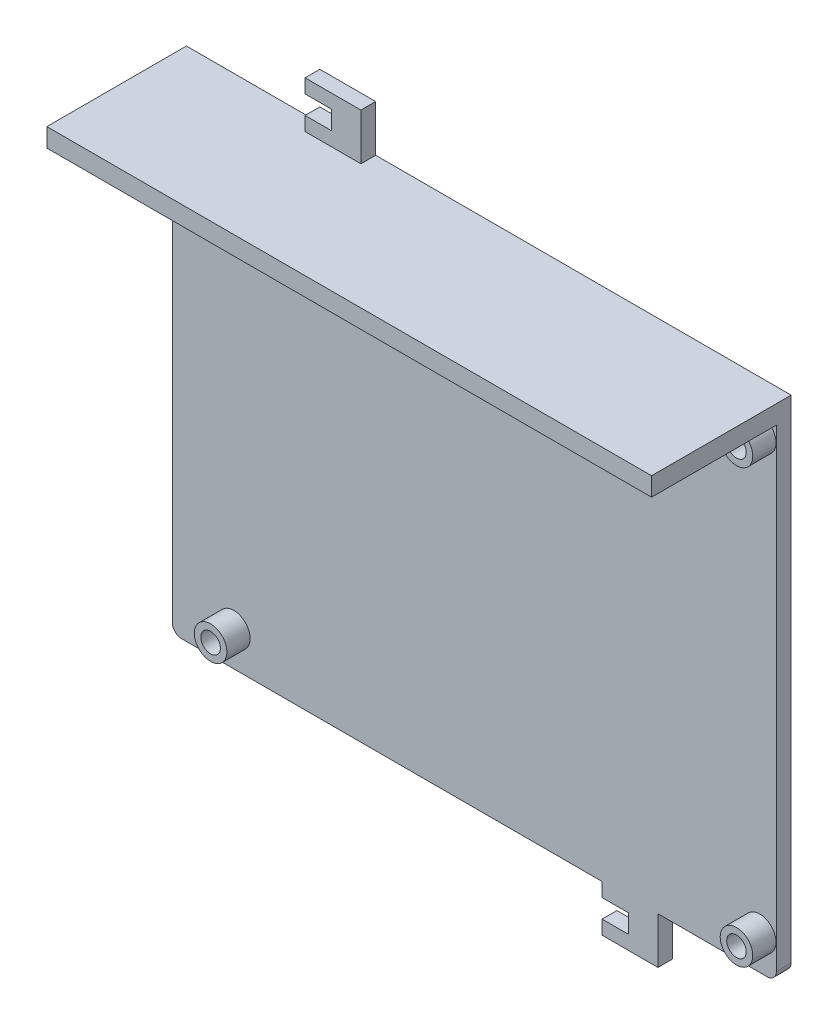
from build123d import *

# Parameters (mm, degrees)
SKETCH1_R             = 3.5
SKETCH1_R_2           = 2.1
BOSS_EXTRUDE1_DEPTH   = 5
BOSS_EXTRUDE1_2_DEPTH = 5
BOSS_EXTRUDE1_3_DEPTH = 5
BOSS_EXTRUDE1_4_DEPTH = 5
SKETCH2_W             = 129.83
SKETCH2_H             = 103.668
BOSS_EXTRUDE2_DEPTH   = 3.175
SKETCH3_W             = 129.972581898
SKETCH3_H             = 4
BOSS_EXTRUDE3_DEPTH   = 30
FILLET1_R             = 2
BOSS_EXTRUDE4_DEPTH   = 3.175


with BuildPart() as part:
    # Sketch1 → Boss-Extrude1 (new body)
    with BuildSketch(Plane(origin=(0, 0, -78.144797939), x_dir=(-1, 0, 0), z_dir=(0, 0, -1))):
        with Locations((153.123589598, -2.351422522)):
            Circle(SKETCH1_R)
        with Locations((153.123589598, -2.351422522)):
            Circle(SKETCH1_R_2, mode=Mode.SUBTRACT)
    extrude(amount=BOSS_EXTRUDE1_DEPTH)



with BuildPart() as body_2:
    # Sketch1 → Boss-Extrude1 2 (new body)
    with BuildSketch(Plane(origin=(0, 0, -78.144797939), x_dir=(-1, 0, 0), z_dir=(0, 0, -1))):
        with Locations((266.153589598, -2.351422522)):
            Circle(SKETCH1_R)
        with Locations((266.153589598, -2.351422522)):
            Circle(SKETCH1_R_2, mode=Mode.SUBTRACT)
    extrude(amount=BOSS_EXTRUDE1_2_DEPTH)


with BuildPart() as body_3:
    # Sketch1 → Boss-Extrude1 3 (new body)
    with BuildSketch(Plane(origin=(0, 0, -78.144797939), x_dir=(-1, 0, 0), z_dir=(0, 0, -1))):
        with Locations((153.123589598, -95.315422522)):
            Circle(SKETCH1_R)
        with Locations((153.123589598, -95.315422522)):
            Circle(SKETCH1_R_2, mode=Mode.SUBTRACT)
    extrude(amount=BOSS_EXTRUDE1_3_DEPTH)


with BuildPart() as body_4:
    # Sketch1 → Boss-Extrude1 4 (new body)
    with BuildSketch(Plane(origin=(0, 0, -78.144797939), x_dir=(-1, 0, 0), z_dir=(0, 0, -1))):
        with Locations((266.153589598, -95.315422522)):
            Circle(SKETCH1_R)
        with Locations((266.153589598, -95.315422522)):
            Circle(SKETCH1_R_2, mode=Mode.SUBTRACT)
    extrude(amount=BOSS_EXTRUDE1_4_DEPTH)


with BuildPart() as part_1:
    add(part.part)

    add(body_2.part)  # Boss-Extrude2 merges body 2

    add(body_3.part)  # Boss-Extrude2 merges body 3

    add(body_4.part)  # Boss-Extrude2 merges body 4
    # Sketch2 → Boss-Extrude2 (add)
    with BuildSketch(Plane(origin=(0, 0, -83.144797939), x_dir=(-1, 0, 0), z_dir=(0, 0, -1))):
        with Locations((214.464589598, -50.865422522)):
            Rectangle(SKETCH2_W, SKETCH2_H)
    extrude(amount=BOSS_EXTRUDE2_DEPTH)

    # Sketch3 → Boss-Extrude3 (add)
    with BuildSketch(Plane(origin=(0, 0, -86.319797939), x_dir=(-1, 0, 0), z_dir=(0, 0, -1))):
        with Locations((214.535880547, 2.968577478)):
            Rectangle(SKETCH3_W, SKETCH3_H)
    extrude(amount=-BOSS_EXTRUDE3_DEPTH)

    # Fillet1
    fillet1_edges = [part_1.edges().sort_by_distance(p)[0] for p in [
        (-279.379589598, -102.699422522, -84.732297939),
        (-149.549589598, -102.699422522, -84.732297939),
    ]]
    fillet(fillet1_edges, radius=FILLET1_R)

    # Sketch4 → Boss-Extrude4 (add)
    with BuildSketch(Plane(origin=(0, 0, -86.319797939), x_dir=(-1, 0, 0), z_dir=(0, 0, -1))):
        Polygon((238.851684859, 14.968577478), (238.851684859, 4.968577478), (250.851684859, 4.968577478), (250.851684859, 7.968577478), (245.201684859, 7.968577478), (245.201684859, 11.968577478), (250.851684859, 11.968577478), (250.851684859, 14.968577478), align=None)
        Polygon((187.002486437, -102.699422522), (175.002486437, -102.699422522), (175.002486437, -112.699422522), (187.002486437, -112.699422522), (187.002486437, -109.699422522), (181.352486437, -109.699422522), (181.352486437, -105.699422522), (187.002486437, -105.699422522), align=None)
    extrude(amount=-BOSS_EXTRUDE4_DEPTH)


solid = part_1.part
